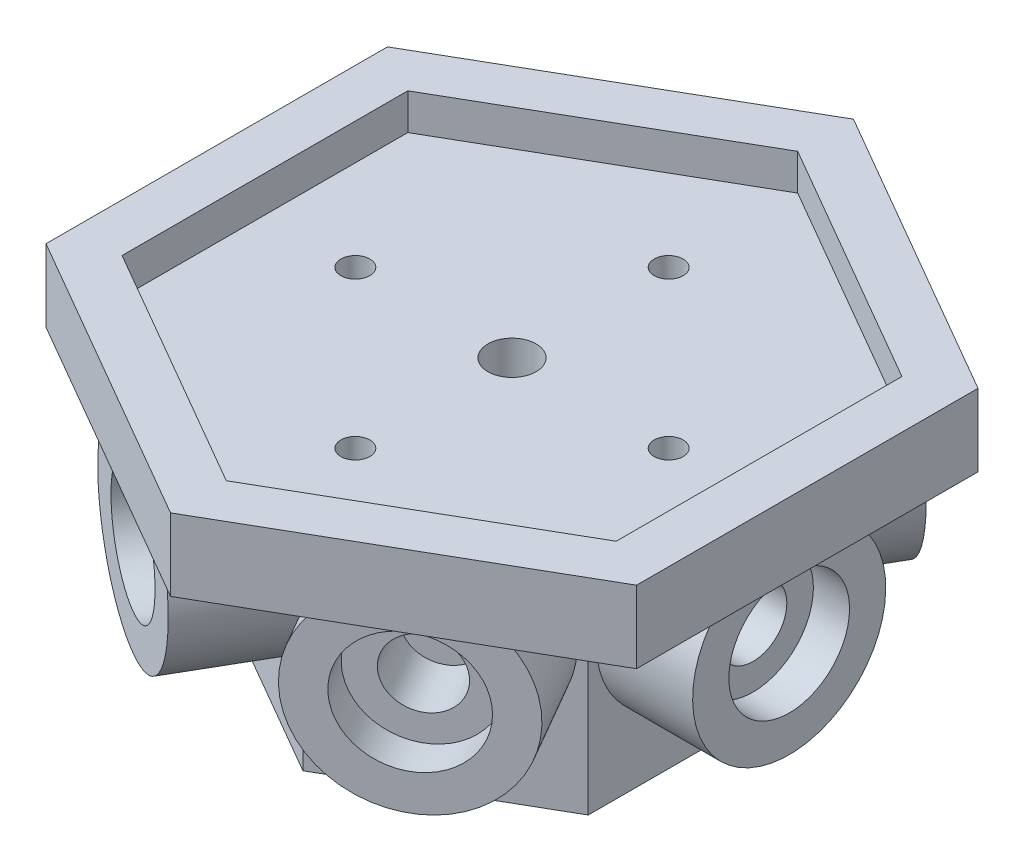
from build123d import *

# Parameters (mm, degrees)
BOSS_EXTRUDE2_DEPTH = 30
CUT_EXTRUDE1_DEPTH  = 15
BOSS_EXTRUDE4_DEPTH = 90
SKETCH7_R           = 10
CUT_EXTRUDE2_DEPTH  = 120
SKETCH8_R           = 25
CUT_EXTRUDE3_DEPTH  = 45
SKETCH9_R           = 40
CUT_EXTRUDE4_DEPTH  = 20
SKETCH10_R          = 6
CUT_EXTRUDE5_DEPTH  = 120
BOSS_EXTRUDE8_DEPTH = 40
SKETCH15_R          = 14
CUT_EXTRUDE7_DEPTH  = 40
SKETCH17_R          = 25
CUT_EXTRUDE8_DEPTH  = 15
CIRPATTERN1_COUNT   = 6


with BuildPart() as part:
    # Sketch3 → Boss-Extrude2 (new body)
    with BuildSketch(Plane(origin=(0, 0, 0), x_dir=(1, 0, 0), z_dir=(0, 1, 0))):
        Polygon((122.447087289, -70.816976409), (122.552844234, 70.633800007), (0.105756945, 141.450776416), (-122.447087289, 70.816976409), (-122.552844234, -70.633800007), (-0.105756945, -141.450776416), align=None)
    extrude(amount=BOSS_EXTRUDE2_DEPTH)

    # Sketch4 → Cut-Extrude1 (cut)
    with BuildSketch(Plane(origin=(0, 30, 0), x_dir=(1, 0, 0), z_dir=(0, 1, 0))):
        Polygon((102.455726099, -59.255021077), (102.544216604, 59.101751026), (0.088490505, 118.356772104), (-102.455726099, 59.255021077), (-102.544216604, -59.101751026), (-0.088490505, -118.356772104), align=None)
    extrude(amount=-CUT_EXTRUDE1_DEPTH, mode=Mode.SUBTRACT)

    # Sketch5 → Boss-Extrude4 (add)
    with BuildSketch(Plane.XZ):
        Polygon((75.032353613, -43.245183678), (74.967604463, 43.357332496), (-0.06474915, 86.602516173), (-75.032353613, 43.245183678), (-74.967604463, -43.357332496), (0.06474915, -86.602516173), align=None)
    extrude(amount=BOSS_EXTRUDE4_DEPTH)

    # Sketch7 → Cut-Extrude2 (cut)
    with BuildSketch(Plane.XZ.offset(90)):
        with Locations(Location((0, 0, 0), (0, 0, 270))):
            Circle(SKETCH7_R)
    extrude(amount=-CUT_EXTRUDE2_DEPTH, mode=Mode.SUBTRACT)

    # Sketch8 → Cut-Extrude3 (cut)
    with BuildSketch(Plane.XZ.offset(90)):
        with Locations(Location((0, 0, 0), (0, 0, 270))):
            Circle(SKETCH8_R)
    extrude(amount=-CUT_EXTRUDE3_DEPTH, mode=Mode.SUBTRACT)

    # Sketch9 → Cut-Extrude4 (cut)
    with BuildSketch(Plane.XZ.offset(90)):
        with Locations(Location((0, 0, 0), (0, 0, 270))):
            Circle(SKETCH9_R)
    extrude(amount=-CUT_EXTRUDE4_DEPTH, mode=Mode.SUBTRACT)

    # Sketch10 → Cut-Extrude5 (cut)
    with BuildSketch(Plane.XZ.offset(90)):
        with Locations(Location((0, 64.95, 0), (0, 0, 270))):
            Circle(SKETCH10_R)
        with Locations(Location((64.95, 0, 0), (0, 0, 270))):
            Circle(SKETCH10_R)
        with Locations(Location((0, -64.95, 0), (0, 0, 270))):
            Circle(SKETCH10_R)
        with Locations(Location((-64.95, 0, 0), (0, 0, 270))):
            Circle(SKETCH10_R)
    extrude(amount=-CUT_EXTRUDE5_DEPTH, mode=Mode.SUBTRACT)

    # Sketch12 → Boss-Extrude8 (add)
    with BuildSketch(Plane(origin=(74.999979038, 0, 0.056074409), x_dir=(0.0007476587847964174, 0, -0.9999997205031317), z_dir=(0.9999997205031318, 0, 0.0007476587847964174))):
        with BuildLine():
            Line((-26.457513111, 0), (26.457513111, 0))
            ThreePointArc((26.457513111, 0), (0, -70), (-26.457513111, 0))
        make_face()
    boss_extrude8 = extrude(amount=BOSS_EXTRUDE8_DEPTH)

    # Sketch15 → Cut-Extrude7 (cut)
    with BuildSketch(Plane(origin=(114.999967858, 0, 0.08598076), x_dir=(0.0007476587847964175, 0, -0.9999997205031317), z_dir=(0.9999997205031318, 0, 0.0007476587847964175))):
        with Locations((0, -30)):
            Circle(SKETCH15_R)
    cut_extrude7 = extrude(amount=-CUT_EXTRUDE7_DEPTH, mode=Mode.SUBTRACT)

    # Sketch17 → Cut-Extrude8 (cut)
    with BuildSketch(Plane(origin=(114.999967858, 0, 0.08598076), x_dir=(0.0007476587847964175, 0, -0.9999997205031317), z_dir=(0.9999997205031318, 0, 0.0007476587847964175))):
        with Locations((0, -30)):
            Circle(SKETCH17_R)
    cut_extrude8 = extrude(amount=-CUT_EXTRUDE8_DEPTH, mode=Mode.SUBTRACT)

    # CirPattern1: Boss-Extrude8, Cut-Extrude7, Cut-Extrude8 ×6 about axis
    cirpattern1_axis = Axis((0, 0, 0), (0, 1, 0))
    add([boss_extrude8.rotate(cirpattern1_axis, i * 360 / CIRPATTERN1_COUNT) for i in range(1, CIRPATTERN1_COUNT)])
    add([cut_extrude7.rotate(cirpattern1_axis, i * 360 / CIRPATTERN1_COUNT) for i in range(1, CIRPATTERN1_COUNT)], mode=Mode.SUBTRACT)
    add([cut_extrude8.rotate(cirpattern1_axis, i * 360 / CIRPATTERN1_COUNT) for i in range(1, CIRPATTERN1_COUNT)], mode=Mode.SUBTRACT)


solid = part.part
